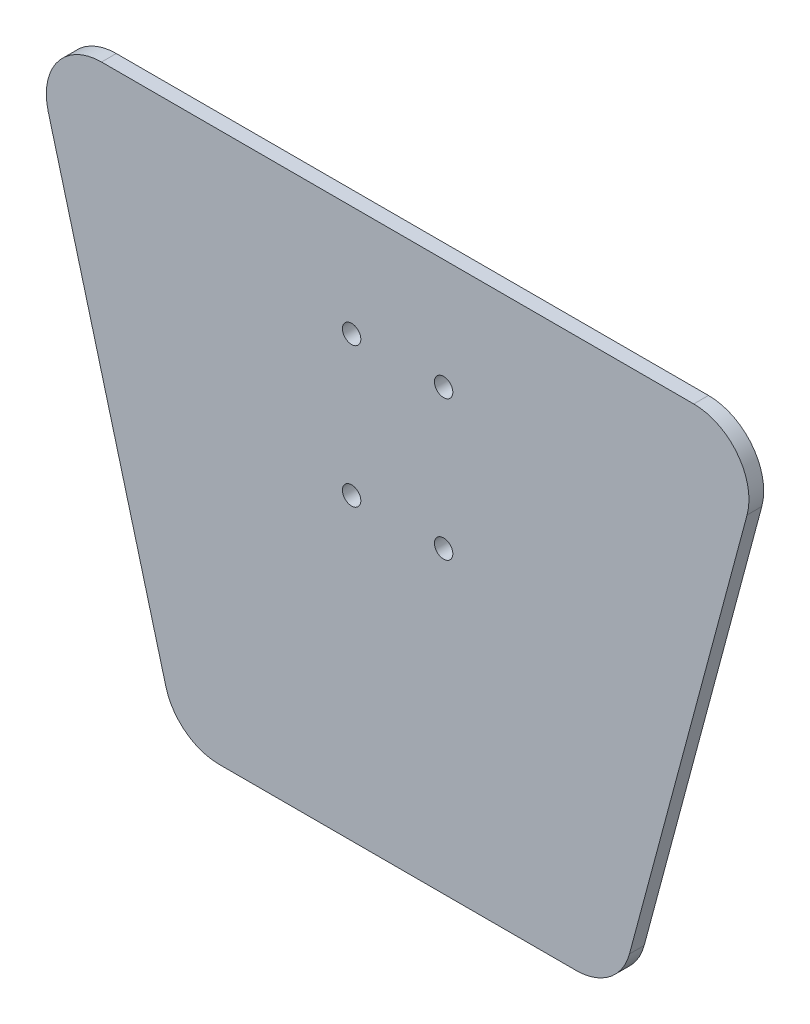
from build123d import *

# Parameters (mm, degrees)
SKETCH_1_R      = 2.5
EXTRUDE_1_DEPTH = 4


with BuildPart() as part:
    # 草图1 → 凸台-拉伸1 (new body)
    with BuildSketch(Plane.XY):
        with BuildLine():
            Line((-11.50990482, 0), (-108.49009518, 0))
            ThreePointArc((-108.49009518, 0), (-117.621516615, 3.099699896), (-122.978982575, 11.117714323))
            Line((-122.978982575, 11.117714323), (-154.940506802, 130.399746626))
            ThreePointArc((-154.940506802, 130.399746626), (-152.351919512, 143.413453738), (-140.451619407, 149.282032303))
            Line((-140.451619407, 149.282032303), (20.451619407, 149.282032303))
            ThreePointArc((20.451619407, 149.282032303), (32.351919512, 143.413453738), (34.940506802, 130.399746626))
            Line((34.940506802, 130.399746626), (2.978982575, 11.117714323))
            ThreePointArc((2.978982575, 11.117714323), (-2.378483385, 3.099699896), (-11.50990482, 0))
        make_face()
        with Locations((-72.5, 81.282032303)):
            Circle(SKETCH_1_R, mode=Mode.SUBTRACT)
        with Locations((-72.5, 119.282032303)):
            Circle(SKETCH_1_R, mode=Mode.SUBTRACT)
        with Locations(Location((-47.5, 81.282032303, 0), (0, 0, 180))):
            Circle(SKETCH_1_R, mode=Mode.SUBTRACT)
        with Locations(Location((-47.5, 119.282032303, 0), (0, 0, 180))):
            Circle(SKETCH_1_R, mode=Mode.SUBTRACT)
    extrude(amount=EXTRUDE_1_DEPTH)


solid = part.part
